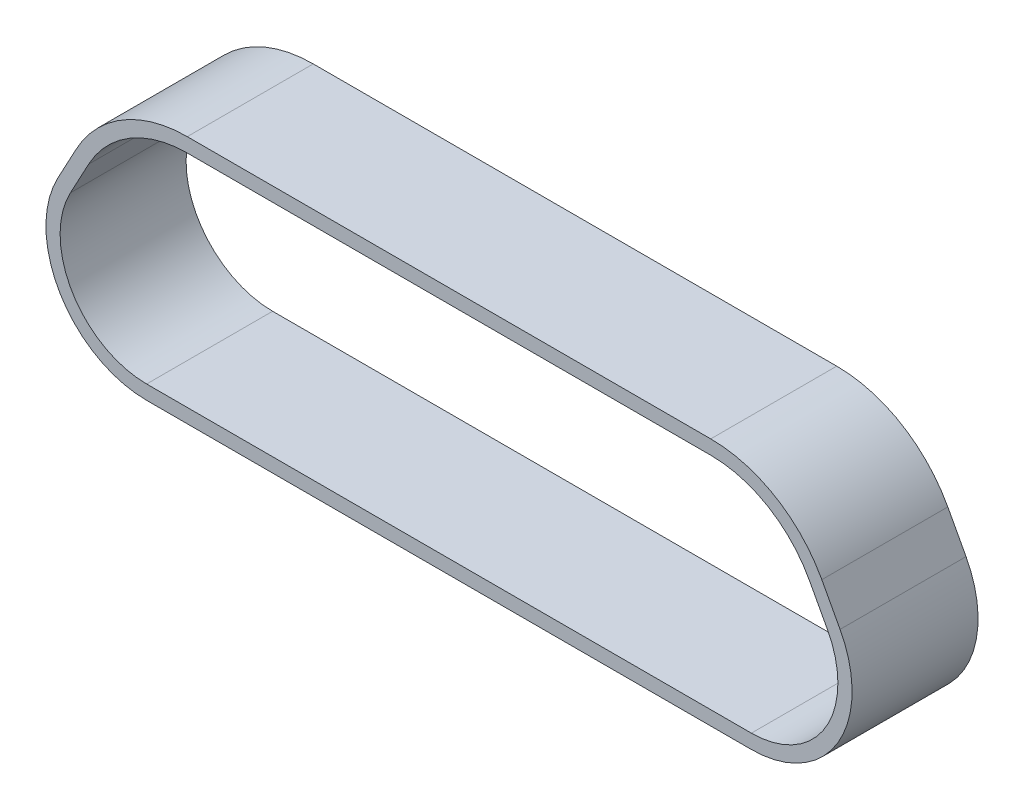
from build123d import *

# Parameters (mm, degrees)
EXTRUDE_1_DEPTH = 40


with BuildPart() as part:
    # ｽｹｯﾁ1 → 押し出し-薄板1 (new body)
    with BuildSketch(Plane.XY):
        with BuildLine():
            Line((83.1, 46.99), (-83.1, 46.99))
            ThreePointArc((-83.1, 46.99), (-103.641692268, 41.319179198), (-118.364790339, 25.913020918))
            Line((-118.364790339, 25.913020918), (-124.157226452, 15.141053415))
            ThreePointArc((-124.157226452, 15.141053415), (-123.44212435, -16.401545999), (-96, -31.97))
            Line((-96, -31.97), (96, -31.97))
            ThreePointArc((96, -31.97), (123.44212435, -16.401545999), (124.157226452, 15.141053415))
            Line((124.157226452, 15.141053415), (118.364790339, 25.913020918))
            ThreePointArc((118.364790339, 25.913020918), (103.641692268, 41.319179198), (83.1, 46.99))
        make_face()
        with BuildLine():
            Line((83.1, 42.49), (-83.1, 42.49))
            ThreePointArc((-83.1, 42.49), (-101.33306052, 37.456509209), (-114.401464752, 23.781812273))
            Line((-114.401464752, 23.781812273), (-120.193900865, 13.00984477))
            ThreePointArc((-120.193900865, 13.00984477), (-119.57945436, -14.092914251), (-96, -27.47))
            Line((-96, -27.47), (96, -27.47))
            ThreePointArc((96, -27.47), (119.57945436, -14.092914251), (120.193900865, 13.00984477))
            Line((120.193900865, 13.00984477), (114.401464752, 23.781812273))
            ThreePointArc((114.401464752, 23.781812273), (101.33306052, 37.456509209), (83.1, 42.49))
        make_face(mode=Mode.SUBTRACT)
    extrude(amount=EXTRUDE_1_DEPTH)


solid = part.part
